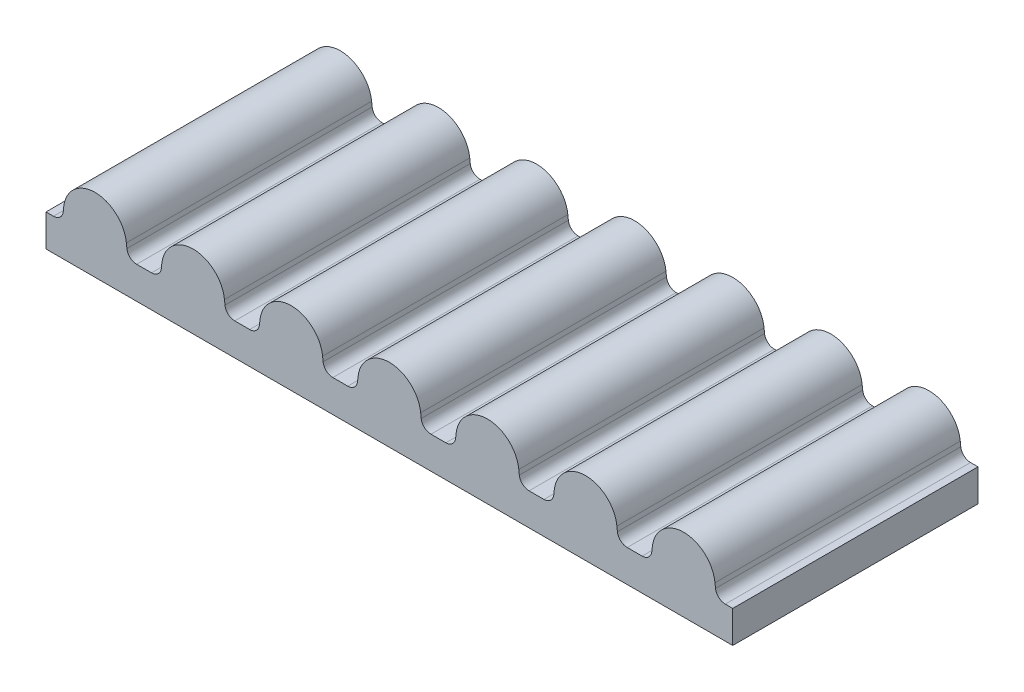
from build123d import *

# Parameters (mm, degrees)
BOSS_EXTRUDE1_DEPTH = 20


with BuildPart() as part:
    # Sketch1 → Boss-Extrude1 (new body)
    with BuildSketch(Plane(origin=(0, 0, -10), x_dir=(-1, 0, 0), z_dir=(0, 0, -1))):
        with BuildLine():
            Line((0, 2.62), (-0.608434486, 2.62))
            ThreePointArc((-0.608434486, 2.62), (-1.142191341, 2.824094286), (-1.403606386, 3.33224095))
            Line((-1.403606386, 3.33224095), (-1.445510274, 3.711925947))
            ThreePointArc((-1.445510274, 3.711925947), (-4, 6), (-6.554489726, 3.711925947))
            Line((-6.554489726, 3.711925947), (-6.596393614, 3.33224095))
            ThreePointArc((-6.596393614, 3.33224095), (-6.857808659, 2.824094286), (-7.391565514, 2.62))
            Line((-7.391565514, 2.62), (-8.608434486, 2.62))
            ThreePointArc((-8.608434486, 2.62), (-9.142191341, 2.824094286), (-9.403606386, 3.33224095))
            Line((-9.403606386, 3.33224095), (-9.445510274, 3.711925947))
            ThreePointArc((-9.445510274, 3.711925947), (-12, 6), (-14.554489726, 3.711925947))
            Line((-14.554489726, 3.711925947), (-14.596393614, 3.33224095))
            ThreePointArc((-14.596393614, 3.33224095), (-14.857808659, 2.824094286), (-15.391565514, 2.62))
            Line((-15.391565514, 2.62), (-16.608434486, 2.62))
            ThreePointArc((-16.608434486, 2.62), (-17.142191341, 2.824094286), (-17.403606386, 3.33224095))
            Line((-17.403606386, 3.33224095), (-17.445510274, 3.711925947))
            ThreePointArc((-17.445510274, 3.711925947), (-20, 6), (-22.554489726, 3.711925947))
            Line((-22.554489726, 3.711925947), (-22.596393614, 3.33224095))
            ThreePointArc((-22.596393614, 3.33224095), (-22.857808659, 2.824094286), (-23.391565514, 2.62))
            Line((-23.391565514, 2.62), (-24.608434486, 2.62))
            ThreePointArc((-24.608434486, 2.62), (-25.142191341, 2.824094286), (-25.403606386, 3.33224095))
            Line((-25.403606386, 3.33224095), (-25.445510274, 3.711925947))
            ThreePointArc((-25.445510274, 3.711925947), (-28, 6), (-30.554489726, 3.711925947))
            Line((-30.554489726, 3.711925947), (-30.596393614, 3.33224095))
            ThreePointArc((-30.596393614, 3.33224095), (-30.857808659, 2.824094286), (-31.391565514, 2.62))
            Line((-31.391565514, 2.62), (-32.608434486, 2.62))
            ThreePointArc((-32.608434486, 2.62), (-33.142191341, 2.824094286), (-33.403606386, 3.33224095))
            Line((-33.403606386, 3.33224095), (-33.445510274, 3.711925947))
            ThreePointArc((-33.445510274, 3.711925947), (-36, 6), (-38.554489726, 3.711925947))
            Line((-38.554489726, 3.711925947), (-38.596393614, 3.33224095))
            ThreePointArc((-38.596393614, 3.33224095), (-38.857808659, 2.824094286), (-39.391565514, 2.62))
            Line((-39.391565514, 2.62), (-40.608434486, 2.62))
            ThreePointArc((-40.608434486, 2.62), (-41.142191341, 2.824094286), (-41.403606386, 3.33224095))
            Line((-41.403606386, 3.33224095), (-41.445510274, 3.711925947))
            ThreePointArc((-41.445510274, 3.711925947), (-44, 6), (-46.554489726, 3.711925947))
            Line((-46.554489726, 3.711925947), (-46.596393614, 3.33224095))
            ThreePointArc((-46.596393614, 3.33224095), (-46.857808659, 2.824094286), (-47.391565514, 2.62))
            Line((-47.391565514, 2.62), (-48.608434486, 2.62))
            ThreePointArc((-48.608434486, 2.62), (-49.142191341, 2.824094286), (-49.403606386, 3.33224095))
            Line((-49.403606386, 3.33224095), (-49.445510274, 3.711925947))
            ThreePointArc((-49.445510274, 3.711925947), (-52, 6), (-54.554489726, 3.711925947))
            Line((-54.554489726, 3.711925947), (-54.596393614, 3.33224095))
            ThreePointArc((-54.596393614, 3.33224095), (-54.857808659, 2.824094286), (-55.391565514, 2.62))
            Line((-55.391565514, 2.62), (-56, 2.62))
            Line((-56, 2.62), (-56, 0))
            Line((-56, 0), (0, 0))
            Line((0, 0), (0, 2.62))
        make_face()
    extrude(amount=-BOSS_EXTRUDE1_DEPTH)


solid = part.part
